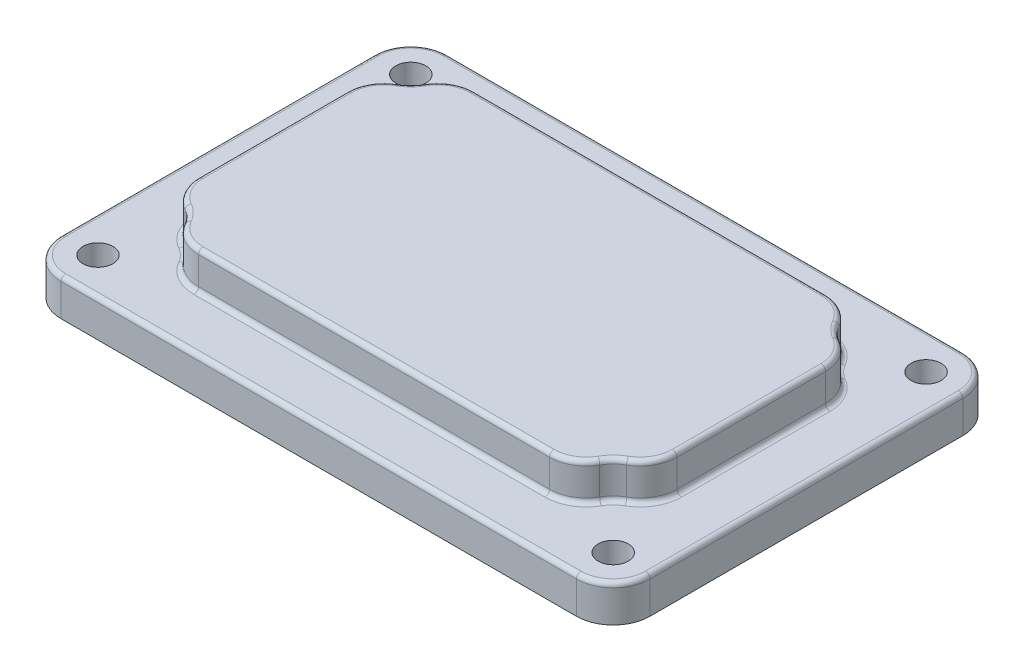
from build123d import *

# Parameters (mm, degrees)
BASE_EXTRUDE_DEPTH   = 6.35
BOSS_SKETCH_W        = 82.55
BOSS_SKETCH_H        = 47.625
TOP_BOSS_DEPTH       = 6.35
BASE_SKETCH_R        = 6.35
BASE_CUT_DEPTH       = 6.35
FILLET_2_R           = 6.35
SHELL_T              = -3.175
CORNER_START         = 3.175
CORNER_SKETCH_R      = 6.35
CORNER_EXTRUDE_DEPTH = 3.175
SHELL_FILLET_R       = 0.7874
DIAMETER_HOLE_D      = 5.1816
EDGE_FILLET_R        = 0.7874
INNER_FILLET_R       = 0.7874
OUTER_FILLET_R       = 0.7874


with BuildPart() as part:
    # Extrude Sketch → Base Extrude (new body)
    with BuildSketch(Plane(origin=(0, 0, 0), x_dir=(1, 0, 0), z_dir=(0, 1, 0))):
        with BuildLine():
            Line((44.45, -33.3375), (-44.45, -33.3375))
            ThreePointArc((-44.45, -33.3375), (-48.940128061, -31.477628061), (-50.8, -26.9875))
            Line((-50.8, -26.9875), (-50.8, 26.9875))
            ThreePointArc((-50.8, 26.9875), (-48.940128061, 31.477628061), (-44.45, 33.3375))
            Line((-44.45, 33.3375), (44.45, 33.3375))
            ThreePointArc((44.45, 33.3375), (48.940128061, 31.477628061), (50.8, 26.9875))
            Line((50.8, 26.9875), (50.8, -26.9875))
            ThreePointArc((50.8, -26.9875), (48.940128061, -31.477628061), (44.45, -33.3375))
        make_face()
    extrude(amount=BASE_EXTRUDE_DEPTH)

    # Boss Sketch → Top Boss (add)
    with BuildSketch(Plane(origin=(0, 6.35, 0), x_dir=(1, 0, 0), z_dir=(0, 1, 0))):
        Rectangle(BOSS_SKETCH_W, BOSS_SKETCH_H)
    extrude(amount=TOP_BOSS_DEPTH)

    # Base Sketch → Base Cut (cut)
    with BuildSketch(Plane(origin=(0, 12.7, 0), x_dir=(1, 0, 0), z_dir=(0, 1, 0))):
        with Locations((41.275, 23.8125)):
            Circle(BASE_SKETCH_R)
        with Locations((-41.275, 23.8125)):
            Circle(BASE_SKETCH_R)
        with Locations((41.275, -23.8125)):
            Circle(BASE_SKETCH_R)
        with Locations((-41.275, -23.8125)):
            Circle(BASE_SKETCH_R)
    extrude(amount=-BASE_CUT_DEPTH, mode=Mode.SUBTRACT)

    # Fillet 2
    fillet_2_edges = [part.edges().sort_by_distance(p)[0] for p in [
        (-34.925, 9.525, -23.8125),
        (-41.275, 9.525, -17.4625),
        (41.275, 9.525, 17.4625),
        (34.925, 9.525, 23.8125),
        (-41.275, 9.525, 17.4625),
        (-34.925, 9.525, 23.8125),
        (41.275, 9.525, -17.4625),
        (34.925, 9.525, -23.8125),
    ]]
    fillet(fillet_2_edges, radius=FILLET_2_R)

    # Shell
    shell_openings = [part.faces().sort_by_distance(p)[0] for p in [
        (0, 0, 0),
    ]]
    offset(amount=SHELL_T, openings=shell_openings, kind=Kind.INTERSECTION)

    # Corner Sketch → Corner Extrude (add)
    with BuildSketch(Plane(origin=(0, 3.175, 0), x_dir=(-1, 0, 0), z_dir=(0, -1, 0)).offset(CORNER_START)):
        with Locations((44.45, -26.9875)):
            Circle(CORNER_SKETCH_R)
        with Locations((-44.45, -26.9875)):
            Circle(CORNER_SKETCH_R)
        with Locations((-44.45, 26.9875)):
            Circle(CORNER_SKETCH_R)
        with Locations((44.45, 26.9875)):
            Circle(CORNER_SKETCH_R)
    extrude(amount=-CORNER_EXTRUDE_DEPTH)

    # Shell Fillet
    shell_fillet_edges = [part.edges().sort_by_distance(p)[0] for p in [
        (-37.674630657, 3.175, -14.401477372),
        (-31.863977372, 3.175, -20.212130657),
        (31.863977372, 3.175, -20.212130657),
        (37.674630657, 3.175, -14.401477372),
        (37.674630657, 3.175, 14.401477372),
        (31.863977372, 3.175, 20.212130657),
        (-31.863977372, 3.175, 20.212130657),
        (-37.674630657, 3.175, 14.401477372),
        (38.1, 3.175, 0),
        (0, 3.175, -20.6375),
        (-38.1, 3.175, 0),
        (0, 3.175, 20.6375),
        (-37.674630657, 9.525, -14.401477372),
        (-38.1, 9.525, 0),
        (-37.674630657, 9.525, 14.401477372),
        (-31.863977372, 9.525, 20.212130657),
        (0, 9.525, 20.6375),
        (31.863977372, 9.525, 20.212130657),
        (37.674630657, 9.525, 14.401477372),
        (38.1, 9.525, 0),
        (37.674630657, 9.525, -14.401477372),
        (31.863977372, 9.525, -20.212130657),
        (0, 9.525, -20.6375),
        (-31.863977372, 9.525, -20.212130657),
        (34.539807909, 9.525, -17.077307909),
        (34.539807909, 3.175, -17.077307909),
        (-34.539807909, 3.175, 17.077307909),
        (-34.539807909, 9.525, 17.077307909),
        (34.539807909, 3.175, 17.077307909),
        (34.539807909, 9.525, 17.077307909),
        (-34.539807909, 3.175, -17.077307909),
        (-34.539807909, 9.525, -17.077307909),
        (47.625, 3.175, 0),
        (39.959871939, 3.175, 22.497371939),
        (47.625, 0, 0),
        (47.625, 1.5875, 21.488238686),
        (38.950738686, 1.5875, 30.1625),
        (39.959871939, 0, 22.497371939),
        (0, 3.175, 30.1625),
        (-39.959871939, 3.175, 22.497371939),
        (0, 0, 30.1625),
        (-38.950738686, 1.5875, 30.1625),
        (-39.959871939, 0, 22.497371939),
        (-47.625, 1.5875, 21.488238686),
        (-47.625, 3.175, 0),
        (-39.959871939, 3.175, -22.497371939),
        (-47.625, 0, 0),
        (-47.625, 1.5875, -21.488238686),
        (-39.959871939, 0, -22.497371939),
        (-38.950738686, 1.5875, -30.1625),
        (0, 3.175, -30.1625),
        (39.959871939, 3.175, -22.497371939),
        (0, 0, -30.1625),
        (38.950738686, 1.5875, -30.1625),
        (47.625, 1.5875, -21.488238686),
        (39.959871939, 0, -22.497371939),
    ]]
    fillet(shell_fillet_edges, radius=SHELL_FILLET_R)

    # Diameter Hole (through all)
    with Locations(Plane(origin=(0, 6.35, 0), x_dir=(1, 0, 0), z_dir=(0, 1, 0))):
        with Locations((-44.45, 26.9875), (44.45, 26.9875), (44.45, -26.9875), (-44.45, -26.9875)):
            Hole(DIAMETER_HOLE_D / 2)

    # Edge Fillet
    edge_fillet_edges = [part.edges().sort_by_distance(p)[0] for p in [
        (-41.275, 12.7, 0),
        (-36.784871939, 12.7, -19.322371939),
        (-36.784871939, 12.7, 19.322371939),
        (0, 12.7, 23.8125),
        (36.784871939, 12.7, 19.322371939),
        (41.275, 12.7, 0),
        (36.784871939, 12.7, -19.322371939),
        (0, 12.7, -23.8125),
        (-40.424261314, 12.7, 15.988977372),
        (-33.451477372, 12.7, 22.961761314),
        (33.451477372, 12.7, 22.961761314),
        (40.424261314, 12.7, 15.988977372),
        (33.451477372, 12.7, -22.961761314),
        (40.424261314, 12.7, -15.988977372),
        (-33.451477372, 12.7, -22.961761314),
        (-40.424261314, 12.7, -15.988977372),
    ]]
    fillet(edge_fillet_edges, radius=EDGE_FILLET_R)

    # Inner Fillet
    inner_fillet_edges = [part.edges().sort_by_distance(p)[0] for p in [
        (-48.940128061, 6.35, -31.477628061),
        (-50.8, 6.35, 0),
        (-48.940128061, 6.35, 31.477628061),
        (0, 6.35, 33.3375),
        (48.940128061, 6.35, 31.477628061),
        (50.8, 6.35, 0),
        (48.940128061, 6.35, -31.477628061),
        (0, 6.35, -33.3375),
    ]]
    fillet(inner_fillet_edges, radius=INNER_FILLET_R)

    # Outer Fillet
    outer_fillet_edges = [part.edges().sort_by_distance(p)[0] for p in [
        (-40.424261314, 6.35, -15.988977372),
        (-33.451477372, 6.35, -22.961761314),
        (40.424261314, 6.35, -15.988977372),
        (33.451477372, 6.35, -22.961761314),
        (40.424261314, 6.35, 15.988977372),
        (33.451477372, 6.35, 22.961761314),
        (-33.451477372, 6.35, 22.961761314),
        (-40.424261314, 6.35, 15.988977372),
        (-41.275, 6.35, 0),
        (-36.784871939, 6.35, -19.322371939),
        (0, 6.35, -23.8125),
        (41.275, 6.35, 0),
        (36.784871939, 6.35, -19.322371939),
        (36.784871939, 6.35, 19.322371939),
        (0, 6.35, 23.8125),
        (-36.784871939, 6.35, 19.322371939),
    ]]
    fillet(outer_fillet_edges, radius=OUTER_FILLET_R)


solid = part.part
